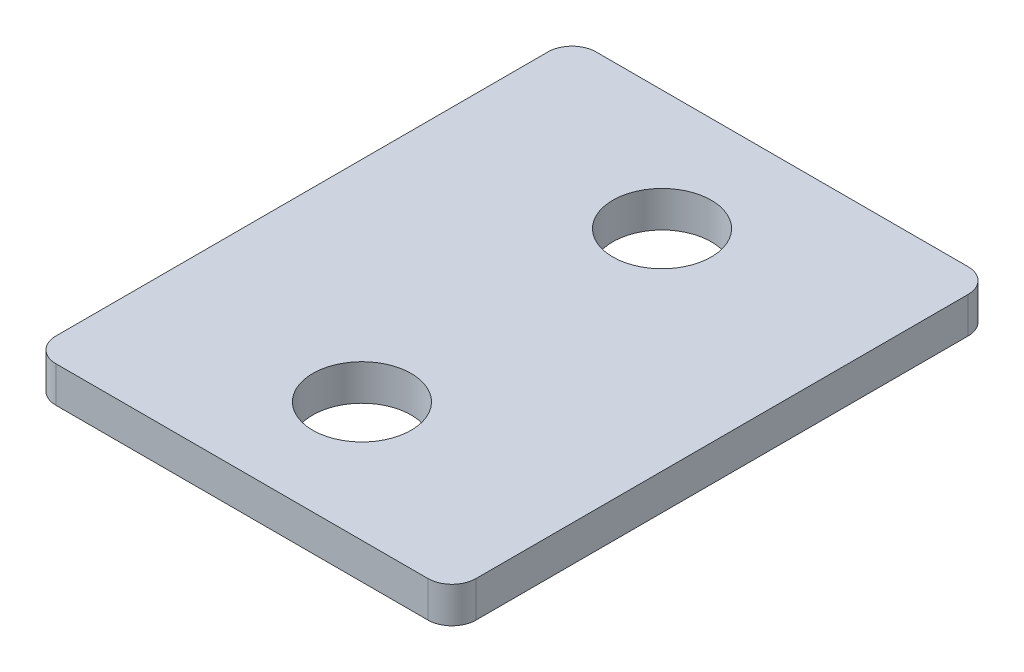
from build123d import *

# Parameters (mm, degrees)
SKETCH1_R           = 4.1
BOSS_EXTRUDE1_DEPTH = 3


with BuildPart() as part:
    # Sketch1 → Boss-Extrude1 (new body)
    with BuildSketch(Plane(origin=(0, 0, 0), x_dir=(1, 0, 0), z_dir=(0, 1, 0))):
        with BuildLine():
            Line((-15.5, -22.5), (15.5, -22.5))
            ThreePointArc((15.5, -22.5), (16.914213562, -21.914213562), (17.5, -20.5))
            Line((17.5, -20.5), (17.5, 20.5))
            ThreePointArc((17.5, 20.5), (16.914213562, 21.914213562), (15.5, 22.5))
            Line((15.5, 22.5), (-15.5, 22.5))
            ThreePointArc((-15.5, 22.5), (-16.914213562, 21.914213562), (-17.5, 20.5))
            Line((-17.5, 20.5), (-17.5, -20.5))
            ThreePointArc((-17.5, -20.5), (-16.914213562, -21.914213562), (-15.5, -22.5))
        make_face()
        with Locations(Location((0, 12.5, 0), (0, 0, 270))):
            Circle(SKETCH1_R, mode=Mode.SUBTRACT)
        with Locations(Location((0, -12.5, 0), (0, 0, 270))):
            Circle(SKETCH1_R, mode=Mode.SUBTRACT)
    extrude(amount=BOSS_EXTRUDE1_DEPTH)


solid = part.part
